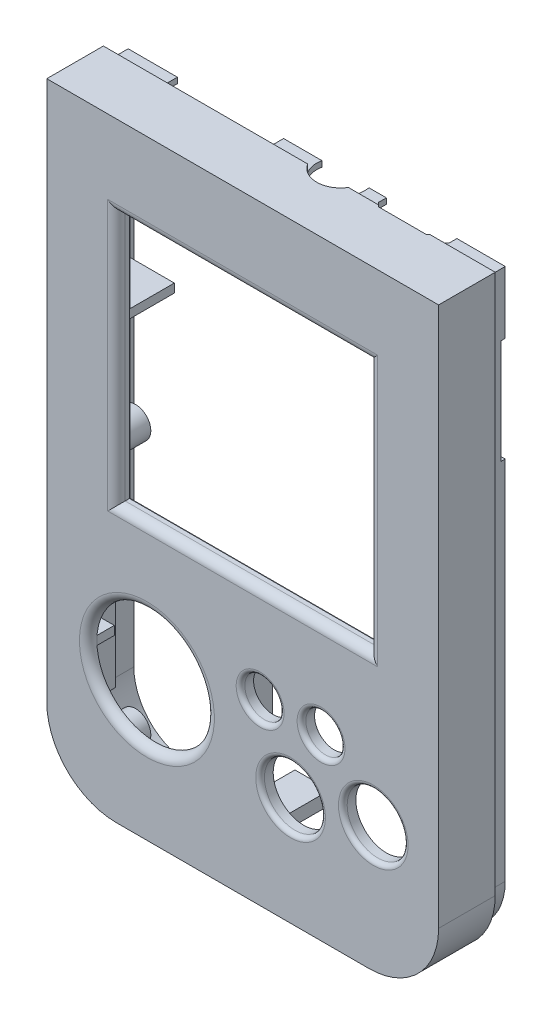
from build123d import *

# Parameters (mm, degrees)
EXTRUDE_1_DEPTH     = 8.5
SHELL_2_T           = -1.5
SKETCH_4_R          = 6.75
SKETCH_4_R_2        = 3.5
SKETCH_4_R_3        = 2.25
SKETCH_4_W          = 29
SKETCH_4_H          = 29
CUT_EXTRUDE_3_DEPTH = 84.649566646
FILLET_1_R          = 1
FILLET_2_R          = 1
FILLET_3_R          = 0.5
SKETCH_5_W          = 33.7
SKETCH_5_H          = 37.6
SKETCH_5_W_2        = 31.7
SKETCH_5_H_2        = 35.6
EXTRUDE_2_DEPTH     = 1.4
SKETCH_6_R          = 1.75
SKETCH_6_R_2        = 0.75
EXTRUDE_3_DEPTH     = 4.2
CUT_EXTRUDE_4_DEPTH = 2
SKETCH_8_W          = 0.65
SKETCH_8_H          = 12
CUT_EXTRUDE_5_DEPTH = 0.5
SKETCH_9_W          = 5.15
SKETCH_9_H          = 1
SKETCH_9_W_2        = 4
SKETCH_9_H_2        = 1.5
EXTRUDE_4_DEPTH     = 6.5
SKETCH_10_R         = 2.75
SKETCH_10_W         = 12.2
SKETCH_10_H         = 1.8
CUT_EXTRUDE_6_DEPTH = 1.5
SKETCH1_R           = 8.25
CUT_EXTRUDE1_DEPTH  = 0.5
SKETCH2_W           = 2
SKETCH2_H           = 1
BOSS_EXTRUDE1_DEPTH = 2
SKETCH_12_W         = 1
SKETCH_12_H         = 15
SKETCH_12_W_2       = 1.5
EXTRUDE_5_DEPTH     = 3.4


with BuildPart() as part:
    # 草图1 → 凸台-拉伸1 (new body)
    with BuildSketch(Plane.XY):
        with BuildLine():
            Line((-45, 70), (0, 70))
            Line((0, 70), (0, 8))
            ThreePointArc((0, 8), (-2.343145751, 2.343145751), (-8, 0))
            Line((-8, 0), (-37, 0))
            ThreePointArc((-37, 0), (-42.656854249, 2.343145751), (-45, 8))
            Line((-45, 8), (-45, 70))
        make_face()
    extrude(amount=EXTRUDE_1_DEPTH)

    # 抽壳2
    shell_2_openings = [part.faces().sort_by_distance(p)[0] for p in [
        (-22.5, 35.292176643, 0),
    ]]
    offset(amount=SHELL_2_T, openings=shell_2_openings, kind=Kind.INTERSECTION)

    # 草图4 → 切除-拉伸3 (cut, through all)
    with BuildSketch(Plane(origin=(0, 0, 0), x_dir=(-1, 0, 0), z_dir=(0, 0, -1))):
        with Locations((33.5, 16)):
            Circle(SKETCH_4_R)
        with Locations((7.5, 14.5)):
            Circle(SKETCH_4_R_2)
        with Locations((17, 12.5)):
            Circle(SKETCH_4_R_2)
        with Locations((13.5, 20.5)):
            Circle(SKETCH_4_R_3)
        with Locations((20.5, 20.5)):
            Circle(SKETCH_4_R_3)
        with Locations((22.5, 46)):
            Rectangle(SKETCH_4_W, SKETCH_4_H)
    extrude(amount=-CUT_EXTRUDE_3_DEPTH, mode=Mode.SUBTRACT)

    # 圆角1
    fillet_1_edges = [part.edges().sort_by_distance(p)[0] for p in [
        (-8, 46, 8.5),
        (-22.5, 60.5, 8.5),
        (-37, 46, 8.5),
        (-22.5, 31.5, 8.5),
    ]]
    fillet(fillet_1_edges, radius=FILLET_1_R)

    # 圆角2
    fillet_2_edges = [part.edges().sort_by_distance(p)[0] for p in [
        (-26.75, 16, 8.5),
    ]]
    fillet(fillet_2_edges, radius=FILLET_2_R)

    # 圆角3
    fillet_3_edges = [part.edges().sort_by_distance(p)[0] for p in [
        (-18.25, 20.5, 8.5),
        (-4, 14.5, 8.5),
        (-13.5, 12.5, 8.5),
        (-11.25, 20.5, 8.5),
    ]]
    fillet(fillet_3_edges, radius=FILLET_3_R)

    # 草图5 → 凸台-拉伸2 (add)
    with BuildSketch(Plane(origin=(0, 0, 7), x_dir=(-1, 0, 0), z_dir=(0, 0, -1))):
        with Locations((22.5, 47.95)):
            Rectangle(SKETCH_5_W, SKETCH_5_H)
        with Locations((22.5, 47.95)):
            Rectangle(SKETCH_5_W_2, SKETCH_5_H_2, mode=Mode.SUBTRACT)
    extrude(amount=EXTRUDE_2_DEPTH)

    # 草图6 → 凸台-拉伸3 (add)
    # profile 1 of 6: a face of its own
    with BuildSketch(Plane(origin=(0, 0, 7), x_dir=(-1, 0, 0), z_dir=(0, 0, -1))):
        with Locations(Location((4.5, 65.5, 0), (0, 0, 311.08233314))):
            Circle(SKETCH_6_R)
        with Locations((4.5, 65.5)):
            Circle(SKETCH_6_R_2, mode=Mode.SUBTRACT)
    # profile 2 of 6: a face of its own
    with BuildSketch(Plane(origin=(0, 0, 7), x_dir=(-1, 0, 0), z_dir=(0, 0, -1))):
        with Locations(Location((4.5, 35.25, 0), (0, 0, 311.08233314))):
            Circle(SKETCH_6_R)
        with Locations((4.5, 35.25)):
            Circle(SKETCH_6_R_2, mode=Mode.SUBTRACT)
    # profile 3 of 6: a face of its own
    with BuildSketch(Plane(origin=(0, 0, 7), x_dir=(-1, 0, 0), z_dir=(0, 0, -1))):
        with Locations((4.5, 5)):
            Circle(SKETCH_6_R)
        with Locations((4.5, 5)):
            Circle(SKETCH_6_R_2, mode=Mode.SUBTRACT)
    # profile 4 of 6: a face of its own
    with BuildSketch(Plane(origin=(0, 0, 7), x_dir=(-1, 0, 0), z_dir=(0, 0, -1))):
        with Locations(Location((40.5, 5, 0), (0, 0, 180))):
            Circle(SKETCH_6_R)
        with Locations(Location((40.5, 5, 0), (0, 0, 180))):
            Circle(SKETCH_6_R_2, mode=Mode.SUBTRACT)
    # profile 5 of 6: a face of its own
    with BuildSketch(Plane(origin=(0, 0, 7), x_dir=(-1, 0, 0), z_dir=(0, 0, -1))):
        with Locations(Location((40.5, 35.25, 0), (0, 0, 180))):
            Circle(SKETCH_6_R)
        with Locations(Location((40.5, 35.25, 0), (0, 0, 180))):
            Circle(SKETCH_6_R_2, mode=Mode.SUBTRACT)
    # profile 6 of 6: a face of its own
    with BuildSketch(Plane(origin=(0, 0, 7), x_dir=(-1, 0, 0), z_dir=(0, 0, -1))):
        with Locations(Location((40.5, 65.5, 0), (0, 0, 180))):
            Circle(SKETCH_6_R)
        with Locations(Location((40.5, 65.5, 0), (0, 0, 180))):
            Circle(SKETCH_6_R_2, mode=Mode.SUBTRACT)
    extrude(amount=EXTRUDE_3_DEPTH)

    # 草图7 → 切除-拉伸4 (cut)
    with BuildSketch(Plane(origin=(0, 0, 0), x_dir=(-1, 0, 0), z_dir=(0, 0, -1))):
        with BuildLine():
            Line((0, 70), (45, 70))
            Line((45, 70), (45, 8))
            ThreePointArc((45, 8), (42.656854249, 2.343145751), (37, 0))
            Line((37, 0), (8, 0))
            ThreePointArc((8, 0), (2.343145751, 2.343145751), (0, 8))
            Line((0, 8), (0, 70))
        make_face()
        with BuildLine():
            Line((0.85, 69.15), (44.15, 69.15))
            Line((44.15, 69.15), (44.15, 8))
            ThreePointArc((44.15, 8), (42.055813485, 2.944186515), (37, 0.85))
            Line((37, 0.85), (8, 0.85))
            ThreePointArc((8, 0.85), (2.944186515, 2.944186515), (0.85, 8))
            Line((0.85, 8), (0.85, 69.15))
        make_face(mode=Mode.SUBTRACT)
    extrude(amount=-CUT_EXTRUDE_4_DEPTH, mode=Mode.SUBTRACT)

    # 草图8 → 切除-拉伸5 (cut)
    with BuildSketch(Plane(origin=(0, 0, 0), x_dir=(-1, 0, 0), z_dir=(0, 0, -1))):
        with Locations((1.175, 56)):
            Rectangle(SKETCH_8_W, SKETCH_8_H)
    extrude(amount=-CUT_EXTRUDE_5_DEPTH, mode=Mode.SUBTRACT)

    # 草图9 → 凸台-拉伸4 (add)
    with BuildSketch(Plane(origin=(0, 0, 7), x_dir=(-1, 0, 0), z_dir=(0, 0, -1))):
        with Locations((40.925, 48.5)):
            Rectangle(SKETCH_9_W, SKETCH_9_H)
        with Locations((22.5, 6.75)):
            Rectangle(SKETCH_9_W_2, SKETCH_9_H_2)
    extrude(amount=EXTRUDE_4_DEPTH)

    # 草图10 → 切除-拉伸6 (cut)
    with BuildSketch(Plane(origin=(0, 70, 0), x_dir=(1, 0, 0), z_dir=(0, 1, 0))):
        with Locations((-19.2, -0.55)):
            Circle(SKETCH_10_R)
        with Locations((-32.4, -0.9)):
            Rectangle(SKETCH_10_W, SKETCH_10_H)
        Polygon((-14.5, 0), (-6.4, 0), (-6.4, -0.9), (-7.7, -2.2), (-13.2, -2.2), (-14.5, -0.9), align=None)
    extrude(amount=-CUT_EXTRUDE_6_DEPTH, mode=Mode.SUBTRACT)

    # Sketch1 → Cut-Extrude1 (cut)
    with BuildSketch(Plane(origin=(0, 0, 7), x_dir=(-1, 0, 0), z_dir=(0, 0, -1))):
        with Locations((33.5, 16)):
            Circle(SKETCH1_R)
    extrude(amount=-CUT_EXTRUDE1_DEPTH, mode=Mode.SUBTRACT)

    # Sketch2 → Boss-Extrude1 (add)
    with BuildSketch(Plane(origin=(0, 0, 7.5), x_dir=(-1, 0, 0), z_dir=(0, 0, -1))):
        with Locations((25.75, 16)):
            Rectangle(SKETCH2_W, SKETCH2_H)
        with Locations((41.25, 16)):
            Rectangle(SKETCH2_W, SKETCH2_H)
    extrude(amount=BOSS_EXTRUDE1_DEPTH)

    # 草图12 → 凸台-拉伸5 (add)
    with BuildSketch(Plane(origin=(0, 0, 7), x_dir=(-1, 0, 0), z_dir=(0, 0, -1))):
        with Locations((24.5, 16)):
            Rectangle(SKETCH_12_W, SKETCH_12_H)
        with Locations((42.75, 16)):
            Rectangle(SKETCH_12_W_2, SKETCH_12_H)
        with Locations((2.25, 16)):
            Rectangle(SKETCH_12_W_2, SKETCH_12_H)
    extrude(amount=EXTRUDE_5_DEPTH)


solid = part.part
